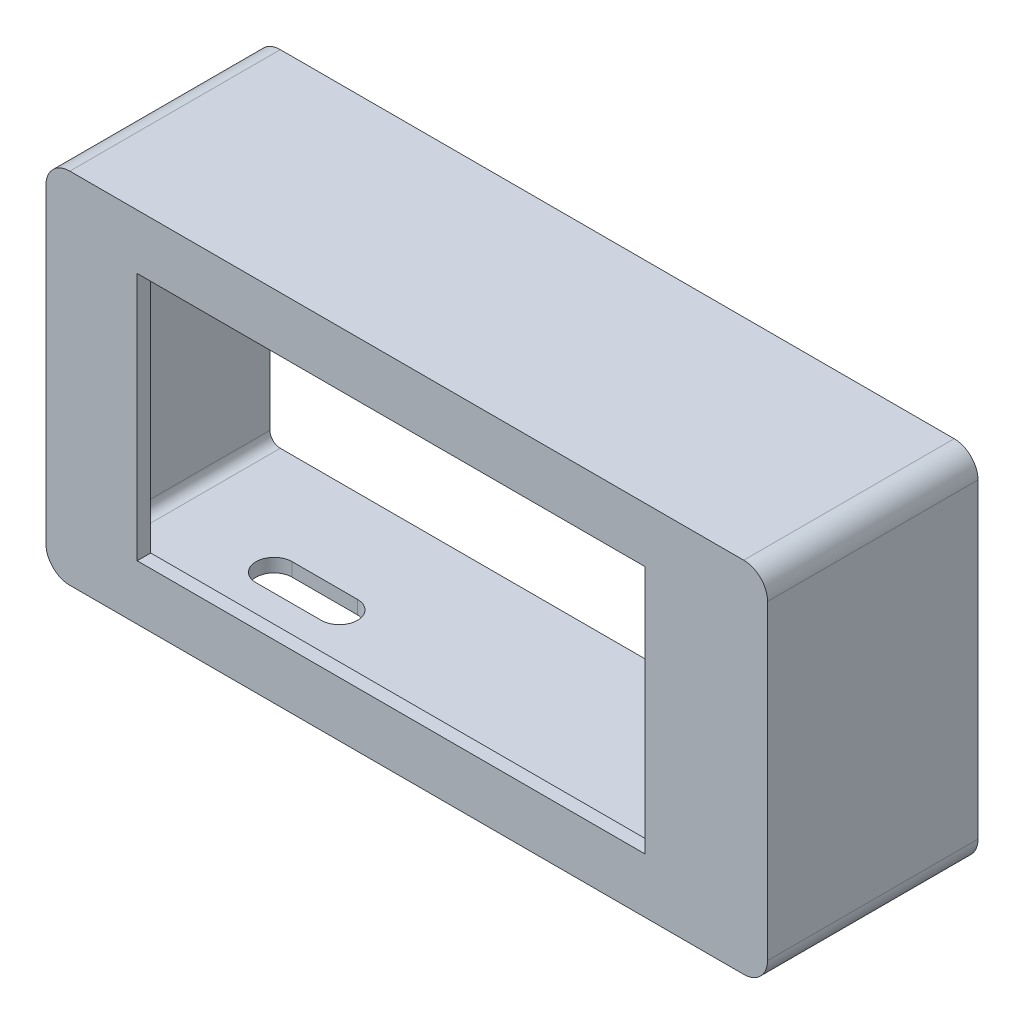
from build123d import *

# Parameters (mm, degrees)
SKETCH_1_W          = 19
SKETCH_1_H          = 32
EXTRUDE_1_DEPTH     = 67
FILLET_1_R          = 1
SHELL_1_T           = 1.3
SKETCH_2_W          = 49
SKETCH_2_H          = 24
CUT_EXTRUDE_1_DEPTH = 74.32305231
CUT_EXTRUDE_2_REACH = 79.322
SKETCH_4_W          = 5.786103887
SKETCH_4_H          = 2
SKETCH_4_W_2        = 5.809063148
EXTRUDE_2_DEPTH     = 1.3


with BuildPart() as part:
    # 草图1 → 凸台-拉伸1 (new body)
    with BuildSketch(Plane(origin=(0, 0, 0), x_dir=(0, 0, -1), z_dir=(1, 0, 0))):
        Rectangle(SKETCH_1_W, SKETCH_1_H)
    extrude(amount=EXTRUDE_1_DEPTH)

    # 圆角1
    fillet_1_edges = [part.edges().sort_by_distance(p)[0] for p in [
        (67, -16, 0),
        (0, -16, 0),
        (0, 16, 0),
        (67, 16, 0),
    ]]
    fillet(fillet_1_edges, radius=FILLET_1_R)

    # 抽壳1
    shell_1_openings = [part.faces().sort_by_distance(p)[0] for p in [
        (33.5, 0, -9.5),
    ]]
    offset(amount=SHELL_1_T, openings=shell_1_openings, kind=Kind.INTERSECTION)

    # 草图2 → 切除-拉伸1 (cut, through all)
    with BuildSketch(Plane.XY.offset(10.8)):
        with Locations((32, 0)):
            Rectangle(SKETCH_2_W, SKETCH_2_H)
    extrude(amount=-CUT_EXTRUDE_1_DEPTH, mode=Mode.SUBTRACT)

    # 草图3 → 切除-拉伸2 (cut, up to next)
    with BuildSketch(Plane.XZ.offset(17.3), mode=Mode.PRIVATE) as cut_extrude_2_sk1:
        with BuildLine():
            Line((11.05, 2.9), (17.35, 2.9))
            ThreePointArc((17.35, 2.9), (19.1, 1.15), (17.35, -0.6))
            Line((17.35, -0.6), (11.05, -0.6))
            ThreePointArc((11.05, -0.6), (9.3, 1.15), (11.05, 2.9))
        make_face()
    cut_extrude_2_tool1 = extrude(cut_extrude_2_sk1.sketch, amount=-CUT_EXTRUDE_2_REACH, mode=Mode.PRIVATE) & part.part
    add(cut_extrude_2_tool1.solids().sort_by_distance((14.2, -17.3, 1.15))[0], mode=Mode.SUBTRACT)

    # 草图4 → 凸台-拉伸2 (add)
    with BuildSketch(Plane.XZ.offset(-16)):
        with Locations((10.323725872, 2)):
            Rectangle(SKETCH_4_W, SKETCH_4_H)
        with Locations((58.142746149, 2)):
            Rectangle(SKETCH_4_W_2, SKETCH_4_H)
    extrude(amount=EXTRUDE_2_DEPTH)


solid = part.part
